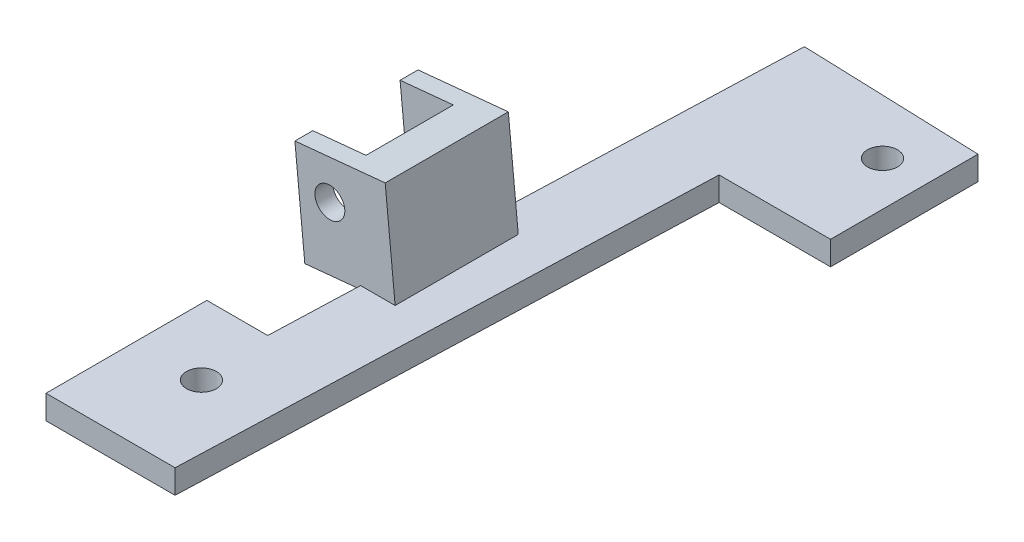
from build123d import *

# Parameters (mm, degrees)
BOSS_EXTRUDE5_DEPTH = 22.352
BOSS_EXTRUDE7_START = -3.81
SKETCH2_R           = 3.175
BOSS_EXTRUDE7_DEPTH = 3.81
BOSS_EXTRUDE8_START = 3.81
SKETCH3_R           = 3.175
BOSS_EXTRUDE8_DEPTH = 3.81
BOSS_EXTRUDE9_DEPTH = 5.08
SKETCH6_R           = 3.175
CUT_EXTRUDE1_DEPTH  = 6.35


with BuildPart() as part:
    # Sketch1 → Boss-Extrude5 (new body)
    with BuildSketch(Plane.XY):
        with BuildLine():
            Line((485.284620904, 141.520479852), (478.661596161, 140.870936716))
            Line((478.661596161, 140.870936716), (479.033472001, 137.079128657))
            Line((479.033472001, 137.079128657), (498.224726786, 138.961281946))
            Line((498.224726786, 138.961281946), (496.114951182, 160.473473003))
            Line((496.114951182, 160.473473003), (488.231748542, 159.700339826))
            ThreePointArc((488.231748542, 159.700339826), (489.092376455, 159.263306748), (489.904354663, 158.741416237))
            ThreePointArc((489.904354663, 158.741416237), (493.83445145, 151.929689602), (491.302607825, 144.484217934))
            ThreePointArc((491.302607825, 144.484217934), (488.563156596, 142.455032775), (485.284620904, 141.520479852))
        make_face()
    extrude(amount=-BOSS_EXTRUDE5_DEPTH)

    # Sketch2 → Boss-Extrude7 (add)
    with BuildSketch(Plane(origin=(0, 0, -22.352), x_dir=(-1, 0, 0), z_dir=(0, 0, -1)).offset(BOSS_EXTRUDE7_START)):
        with BuildLine():
            Line((-476.923696397, 158.591319714), (-478.661596161, 140.870936716))
            Line((-478.661596161, 140.870936716), (-485.284620904, 141.520479852))
            ThreePointArc((-485.284620904, 141.520479852), (-493.757189232, 149.475804861), (-488.231748542, 159.700339826))
            Line((-488.231748542, 159.700339826), (-476.923696397, 158.591319714))
        make_face()
        with Locations(Location((-484.354931302, 151, 0), (0, 0, 90))):
            Circle(SKETCH2_R, mode=Mode.SUBTRACT)
    extrude(amount=BOSS_EXTRUDE7_DEPTH)

    # Sketch3 → Boss-Extrude8 (add)
    # profile 1 of 2: a face of its own
    with BuildSketch(Plane.XY.offset(BOSS_EXTRUDE8_START)):
        with BuildLine():
            Line((488.231748542, 159.700339826), (476.923696397, 158.591319714))
            Line((476.923696397, 158.591319714), (478.661596161, 140.870936716))
            Line((478.661596161, 140.870936716), (485.284620904, 141.520479852))
            ThreePointArc((485.284620904, 141.520479852), (493.757189232, 149.475804861), (488.231748542, 159.700339826))
        make_face()
        with Locations(Location((484.354931302, 151, 0), (0, 0, 90))):
            Circle(SKETCH3_R, mode=Mode.SUBTRACT)
    # profile 2 of 2: a face of its own
    with BuildSketch(Plane.XY.offset(BOSS_EXTRUDE8_START)):
        with BuildLine():
            Line((496.114951182, 160.473473003), (488.231748542, 159.700339826))
            ThreePointArc((488.231748542, 159.700339826), (493.757189232, 149.475804861), (485.284620904, 141.520479852))
            Line((485.284620904, 141.520479852), (478.661596161, 140.870936716))
            Line((478.661596161, 140.870936716), (479.033472001, 137.079128657))
            Line((479.033472001, 137.079128657), (498.224726786, 138.961281946))
            Line((498.224726786, 138.961281946), (496.114951182, 160.473473003))
        make_face()
    extrude(amount=-BOSS_EXTRUDE8_DEPTH)

    # Sketch4 → Boss-Extrude9 (add)
    with BuildSketch(Plane(origin=(0, 138.961281946, 0), x_dir=(1, 0, 0), z_dir=(0, 1, 0))):
        Polygon((494.072487043, 87.311338989), (532.291432121, 85.970092731), (532.291432121, 54.640280545), (508.611718184, 54.640280545), (504.692489504, -57.038529169), (477.269374414, -57.038529169), (477.269374414, -22.86), (490.206161169, -22.86), align=None)
    extrude(amount=-BOSS_EXTRUDE9_DEPTH)

    # Sketch6 → Cut-Extrude1 (cut)
    with BuildSketch(Plane(origin=(0, 138.961281946, 0), x_dir=(1, 0, 0), z_dir=(0, 1, 0))):
        with Locations(Location((491.366130704, -38.105065935, 0), (0, 0, 270))):
            Circle(SKETCH6_R)
        with Locations(Location((522.91714349, 75.049167666, 0), (0, 0, 270))):
            Circle(SKETCH6_R)
    extrude(amount=-CUT_EXTRUDE1_DEPTH, mode=Mode.SUBTRACT)


solid = part.part
